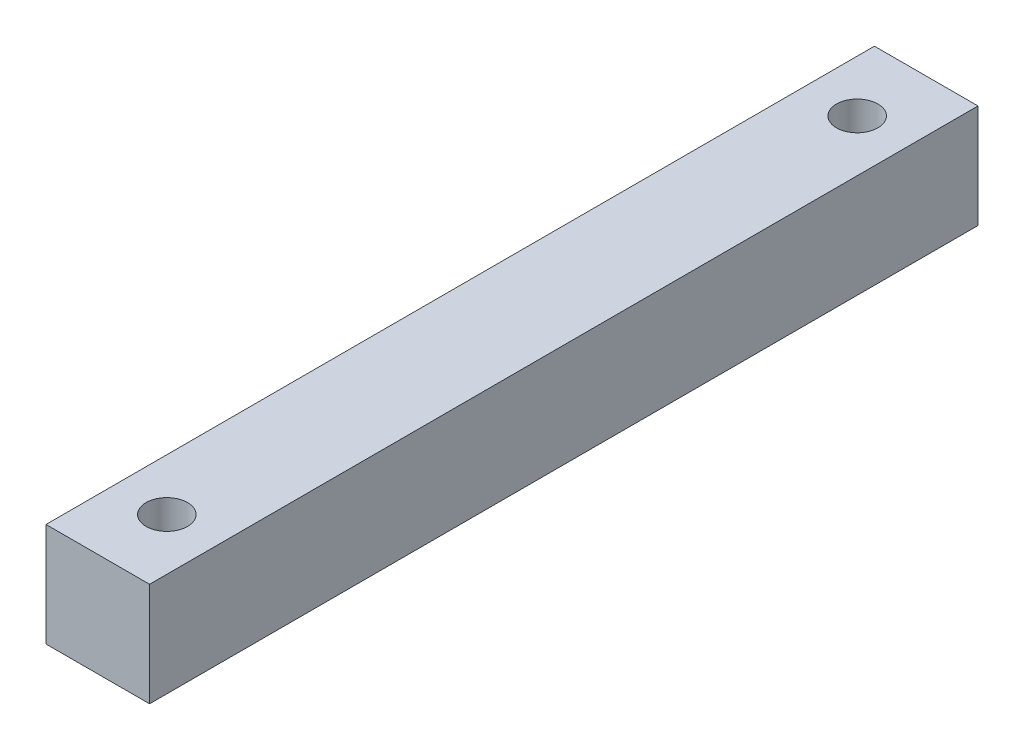
from build123d import *

# Parameters (mm, degrees)
SKETCH_1_W          = 15
SKETCH_1_H          = 15
EXTRUDE_1_DEPTH     = 120
SKETCH_2_R          = 3
CUT_EXTRUDE_1_DEPTH = 122.86057607


with BuildPart() as part:
    # 草图1 → 凸台-拉伸1 (new body)
    with BuildSketch(Plane.XY):
        with Locations((7.5, -7.5)):
            Rectangle(SKETCH_1_W, SKETCH_1_H)
    extrude(amount=EXTRUDE_1_DEPTH)

    # 草图2 → 切除-拉伸1 (cut, through all)
    with BuildSketch(Plane(origin=(0, 0, 0), x_dir=(1, 0, 0), z_dir=(0, 1, 0))):
        with Locations(Location((7.5, -10, 0), (0, 0, 270))):
            Circle(SKETCH_2_R)
        with Locations(Location((7.5, -110, 0), (0, 0, 270))):
            Circle(SKETCH_2_R)
    extrude(amount=-CUT_EXTRUDE_1_DEPTH, mode=Mode.SUBTRACT)


solid = part.part
